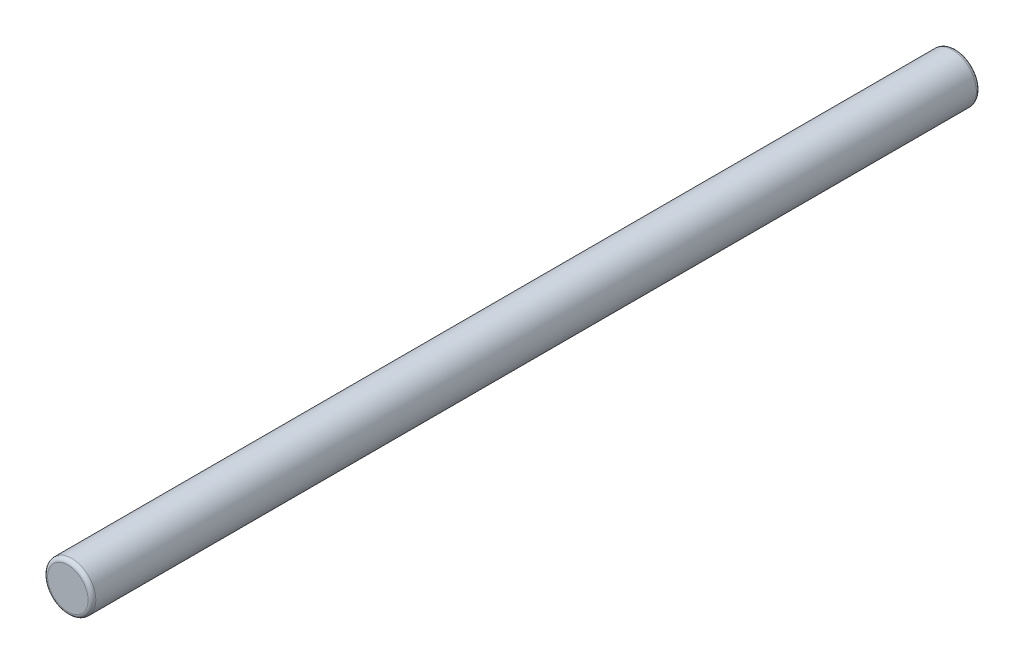
from build123d import *

# Parameters (mm, degrees)
Y_KSEKLIK_EKSTR_ZYON1_DEPTH      = 230
Y_KSEKLIK_EKSTR_ZYON1_DEPTH_BACK = 230
IZIM1_R                          = 12.5
IZIM2_R                          = 4.25
KES_EKSTR_ZYON1_DEPTH            = 50
RADYUS1_R                        = 2


with BuildPart() as part:
    # Çizim1 → Yükseklik-Ekstrüzyon1 (new, two sides: drawn at the far end of the back side and taken through both)
    with BuildSketch(Plane.XY.offset(-Y_KSEKLIK_EKSTR_ZYON1_DEPTH_BACK)):
        Circle(IZIM1_R)
    extrude(amount=Y_KSEKLIK_EKSTR_ZYON1_DEPTH + Y_KSEKLIK_EKSTR_ZYON1_DEPTH_BACK)

    # Çizim2 → Kes-Ekstrüzyon1 (cut)
    with BuildSketch(Plane(origin=(0, 0, 0), x_dir=(1, 0, 0), z_dir=(0, 1, 0))):
        with Locations((0, 100)):
            Circle(IZIM2_R)
        with Locations((0, -100)):
            Circle(IZIM2_R)
    extrude(amount=-KES_EKSTR_ZYON1_DEPTH, mode=Mode.SUBTRACT)

    # Radyus1
    radyus1_edges = [part.edges().sort_by_distance(p)[0] for p in [
        (-12.5, 0, 230),
        (-12.5, 0, -230),
    ]]
    fillet(radyus1_edges, radius=RADYUS1_R)


solid = part.part
